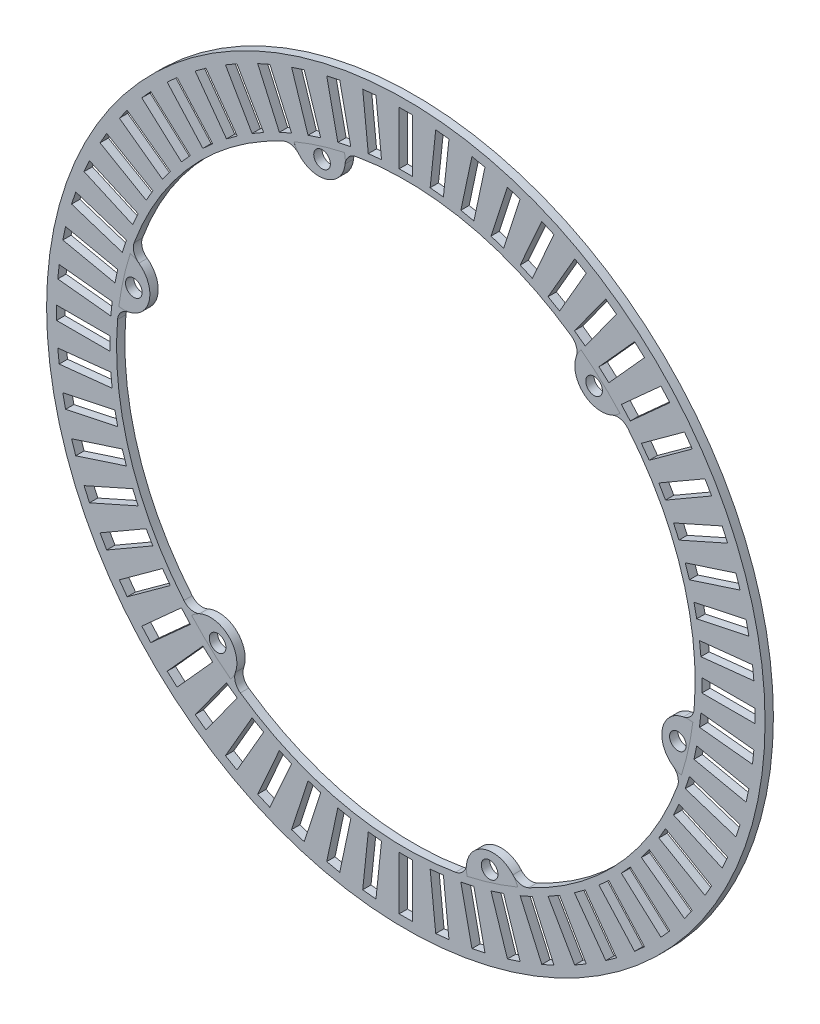
from build123d import *

# Parameters (mm, degrees)
SKETCH1_R                 = 68.500625
SKETCH1_R_2               = 55.165625
BOSS_EXTRUDE1_DEPTH       = 1.5875
SKETCH4_W                 = 2.54
SKETCH4_H                 = 10.16
CUT_EXTRUDE3_DEPTH        = 5.08
CIRPATTERN2_COUNT         = 60
BOSS_EXTRUDE2_START       = -1.5875
BOSS_EXTRUDE2_DEPTH       = 1.587512
FILLET1_R                 = 2.54
SKETCH9_R                 = 1.5875
CUT_EXTRUDE6_DEPTH        = 97.887519696
CIRPATTERN12_COUNT        = 6
FILLET1_OF_CIRPATTERN12_R = 2.54


with BuildPart() as part:
    # Sketch1 → Boss-Extrude1 (new body)
    with BuildSketch(Plane.XY):
        Circle(SKETCH1_R)
        Circle(SKETCH1_R_2, mode=Mode.SUBTRACT)
    extrude(amount=BOSS_EXTRUDE1_DEPTH)

    # Sketch4 → Cut-Extrude3 (cut)
    with BuildSketch(Plane.XY.offset(1.5875)):
        with Locations((0, 61.515625)):
            Rectangle(SKETCH4_W, SKETCH4_H)
    cut_extrude3 = extrude(amount=-CUT_EXTRUDE3_DEPTH, mode=Mode.SUBTRACT)

    # CirPattern2: Cut-Extrude3 ×60 about axis
    cirpattern2_axis = Axis((0, 0, 0), (0, 0, 1))
    for i in range(1, CIRPATTERN2_COUNT):
        add(cut_extrude3.rotate(cirpattern2_axis, i * 360 / CIRPATTERN2_COUNT), mode=Mode.SUBTRACT)

    # Sketch8 → Boss-Extrude2 (add)
    with BuildSketch(Plane.XY.offset(1.5875).offset(BOSS_EXTRUDE2_START)):
        with BuildLine():
            ThreePointArc((54.724288949, -6.964077875), (48.926905763, -10.846833867), (52.540195701, -16.815885863))
            ThreePointArc((52.540195701, -16.815885863), (53.857979418, -11.940026578), (54.724288949, -6.964077875))
        make_face()
    boss_extrude2 = extrude(amount=BOSS_EXTRUDE2_DEPTH)

    # Fillet1
    fillet1_edges = [part.edges().sort_by_distance(p)[0] for p in [
        (54.724288949, -6.964077875, 0.79375),
        (52.540195701, -16.815885863, 0.79375),
    ]]
    fillet(fillet1_edges, radius=FILLET1_R)

    # Sketch9 → Cut-Extrude6 (cut, symmetric)
    with BuildSketch(Plane.XY.offset(1.587512)):
        with Locations((51.866158987, -11.498450619)):
            Circle(SKETCH9_R)
    cut_extrude6 = extrude(amount=CUT_EXTRUDE6_DEPTH, both=True, mode=Mode.SUBTRACT)

    # CirPattern12: Boss-Extrude2, Cut-Extrude6 ×6 about axis
    cirpattern12_axis = Axis((0, 0, 0), (0, 0, 1))
    add([boss_extrude2.rotate(cirpattern12_axis, i * 360 / CIRPATTERN12_COUNT) for i in range(1, CIRPATTERN12_COUNT)])
    add([cut_extrude6.rotate(cirpattern12_axis, i * 360 / CIRPATTERN12_COUNT) for i in range(1, CIRPATTERN12_COUNT)], mode=Mode.SUBTRACT)

    # Fillet1 of CirPattern12
    fillet1_of_cirpattern12_edges = [part.edges().sort_by_distance(p)[0] for p in [
        (33.393212829, 43.910585496, 0.79375),
        (40.833082195, 37.093201266, 0.79375),
        (-21.33107612, 50.874663372, 0.79375),
        (-11.707113506, 53.909087128, 0.79375),
        (-54.724288949, 6.964077875, 0.79375),
        (-52.540195701, 16.815885863, 0.79375),
        (-33.393212829, -43.910585496, 0.79375),
        (-40.833082195, -37.093201266, 0.79375),
        (21.33107612, -50.874663372, 0.79375),
        (11.707113506, -53.909087128, 0.79375),
    ]]
    fillet(fillet1_of_cirpattern12_edges, radius=FILLET1_OF_CIRPATTERN12_R)


solid = part.part
